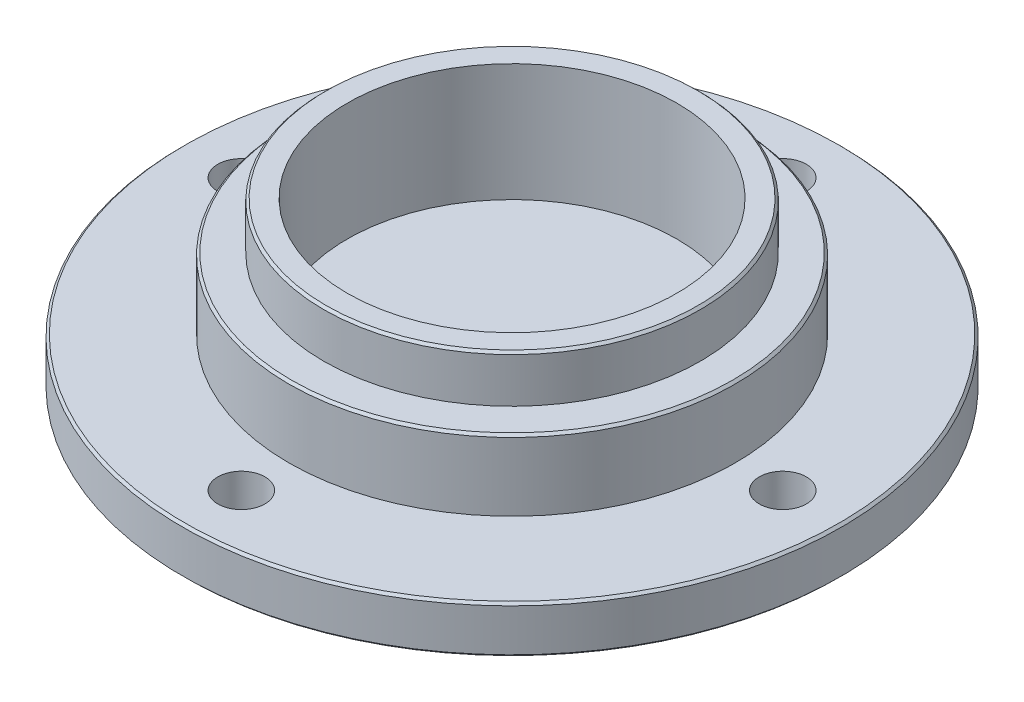
from build123d import *

# Parameters (mm, degrees)
SKETCH_1_R          = 47.4
EXTRUDE_1_DEPTH     = 15
SKETCH_2_R          = 40
EXTRUDE_2_DEPTH     = 10
SKETCH_3_R          = 70
SKETCH_3_R_2        = 5
EXTRUDE_3_DEPTH     = 10
SKETCH_4_R          = 35
CUT_EXTRUDE_1_DEPTH = 25
CHAMFER_1_SIZE      = 0.5


with BuildPart() as part:
    # 草图1 → 凸台-拉伸1 (new body)
    with BuildSketch(Plane(origin=(0, 0, 0), x_dir=(1, 0, 0), z_dir=(0, 1, 0))):
        with Locations(Location((0, 0, 0), (0, 0, 270))):
            Circle(SKETCH_1_R)
    extrude(amount=EXTRUDE_1_DEPTH)

    # 草图2 → 凸台-拉伸2 (add)
    with BuildSketch(Plane(origin=(0, 15, 0), x_dir=(1, 0, 0), z_dir=(0, 1, 0))):
        with Locations(Location((0, 0, 0), (0, 0, 270))):
            Circle(SKETCH_2_R)
    extrude(amount=EXTRUDE_2_DEPTH)

    # 草图3 → 凸台-拉伸3 (add)
    with BuildSketch(Plane.XZ):
        with Locations(Location((0, 0, 0), (0, 0, 270))):
            Circle(SKETCH_3_R)
        with Locations(Location((0, 57.5, 0), (0, 0, 270))):
            Circle(SKETCH_3_R_2, mode=Mode.SUBTRACT)
        with Locations(Location((57.5, 0, 0), (0, 0, 270))):
            Circle(SKETCH_3_R_2, mode=Mode.SUBTRACT)
        with Locations(Location((0, -57.5, 0), (0, 0, 270))):
            Circle(SKETCH_3_R_2, mode=Mode.SUBTRACT)
        with Locations(Location((-57.5, 0, 0), (0, 0, 270))):
            Circle(SKETCH_3_R_2, mode=Mode.SUBTRACT)
    extrude(amount=EXTRUDE_3_DEPTH)

    # 草图4 → 切除-拉伸1 (cut)
    with BuildSketch(Plane(origin=(0, 25, 0), x_dir=(1, 0, 0), z_dir=(0, 1, 0))):
        with Locations(Location((0, 0, 0), (0, 0, 270))):
            Circle(SKETCH_4_R)
    extrude(amount=-CUT_EXTRUDE_1_DEPTH, mode=Mode.SUBTRACT)

    # 倒角1
    chamfer_1_edges = [part.edges().sort_by_distance(p)[0] for p in [
        (0, 0, 70),
        (0, 15, -47.4),
        (0, 25, -40),
        (0, -10, 70),
    ]]
    chamfer(chamfer_1_edges, length=CHAMFER_1_SIZE)


solid = part.part
